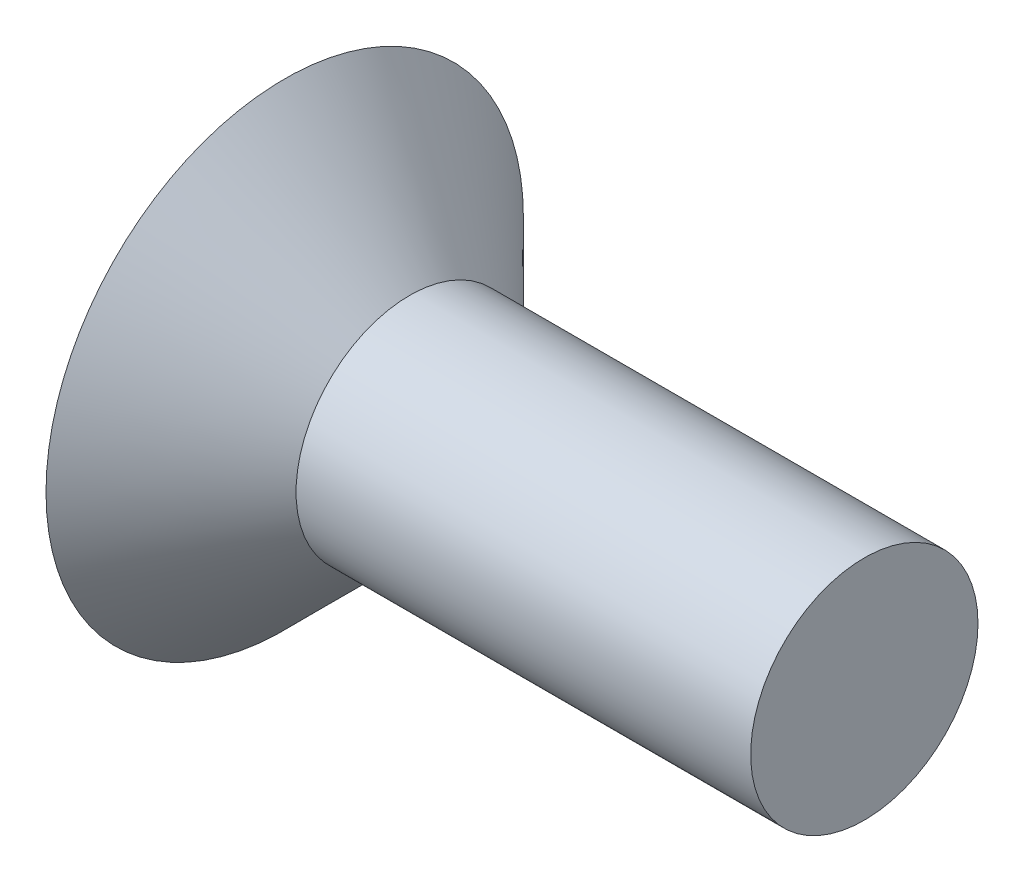
from build123d import *


with BuildPart() as part:
    # Эскиз1 → Повернуть1 (revolve)
    with BuildSketch(Plane.XY, mode=Mode.PRIVATE) as revolve_1_sk:
        Polygon((0, 0), (0, 3.15), (1.65, 1.5), (7.65, 1.5), (7.65, 0), align=None)
    revolve(revolve_1_sk.sketch.rotate(Axis((0, 0, 0), (-1, 0, 0)), 90), axis=Axis((0, 0, 0), (-1, 0, 0)))


solid = part.part
